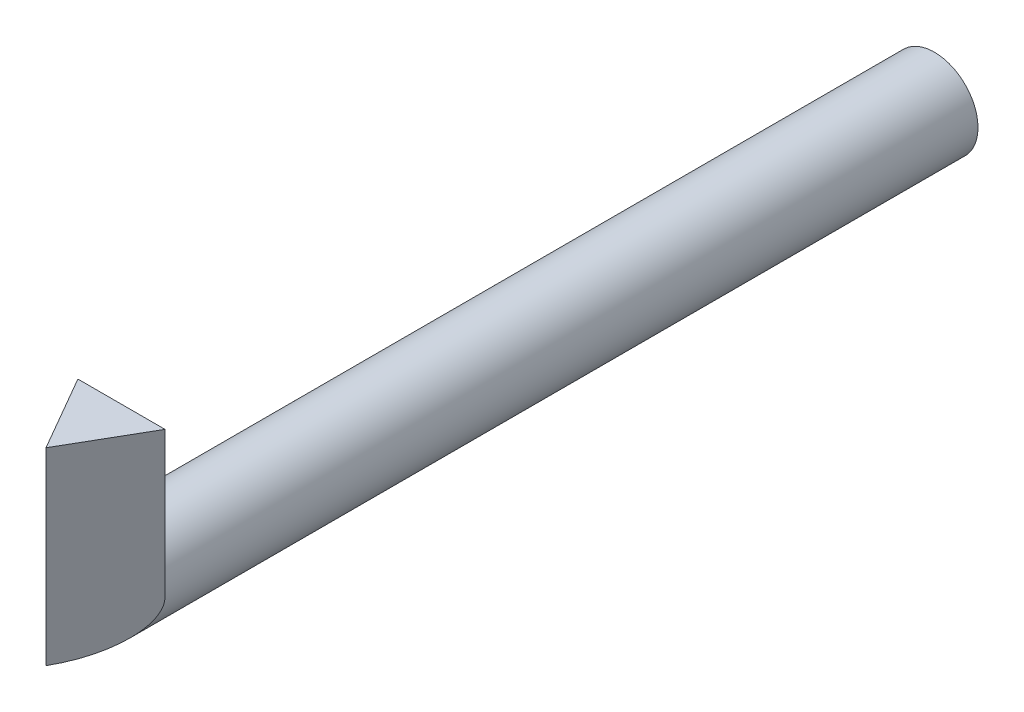
from build123d import *

# Parameters (mm, degrees)
SKETCH_5_R          = 1.5
EXTRUDE_4_DEPTH     = 31
SKETCH_6_W          = 3
SKETCH_6_H          = 1.5
CUT_EXTRUDE_2_DEPTH = 3
CUT_EXTRUDE_3_DEPTH = 1.5
EXTRUDE_5_DEPTH     = 5


with BuildPart() as part:
    # 草图5 → 凸台-拉伸4 (new body)
    with BuildSketch(Plane.XY):
        Circle(SKETCH_5_R)
    extrude(amount=EXTRUDE_4_DEPTH)

    # 草图6 → 切除-拉伸2 (cut)
    with BuildSketch(Plane.XY.offset(31)):
        with Locations((0, 0.75)):
            Rectangle(SKETCH_6_W, SKETCH_6_H)
    extrude(amount=-CUT_EXTRUDE_2_DEPTH, mode=Mode.SUBTRACT)

    # 草图7 → 切除-拉伸3 (cut)
    with BuildSketch(Plane(origin=(0, 0, 0), x_dir=(1, 0, 0), z_dir=(0, 1, 0))):
        Polygon((-1.5, -28), (0, -30.598076211), (1.5, -28), (1.5, -31), (-1.5, -31), align=None)
    extrude(amount=-CUT_EXTRUDE_3_DEPTH, mode=Mode.SUBTRACT)

    # 草图8 → 凸台-拉伸5 (add)
    with BuildSketch(Plane(origin=(0, 0, 0), x_dir=(1, 0, 0), z_dir=(0, 1, 0))):
        Polygon((0, -30.598076211), (1.5, -28), (-1.5, -28), align=None)
    extrude(amount=EXTRUDE_5_DEPTH)


solid = part.part
